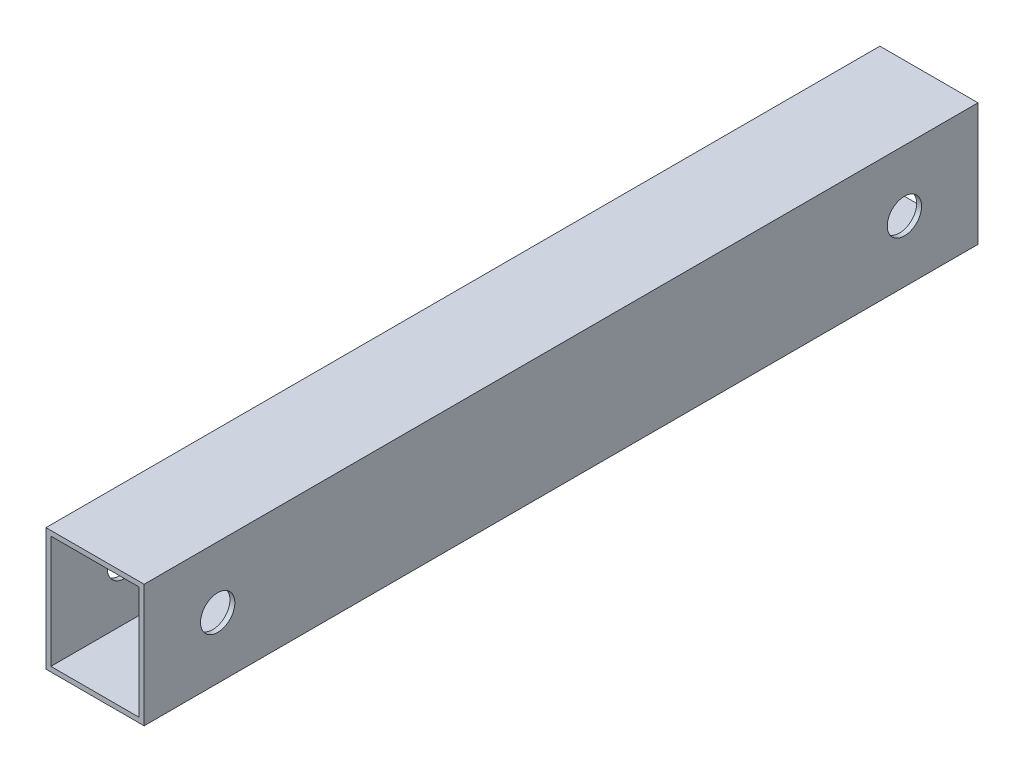
from build123d import *

# Parameters (mm, degrees)
SKETCH1_W           = 20
SKETCH1_H           = 25
BOSS_EXTRUDE1_DEPTH = 170
SHELL1_T            = -1
SKETCH2_R           = 3.5
CUT_EXTRUDE1_DEPTH  = 170


with BuildPart() as part:
    # Sketch1 → Boss-Extrude1 (new body)
    with BuildSketch(Plane.XY):
        with Locations((-15.769295372, -6.071428571)):
            Rectangle(SKETCH1_W, SKETCH1_H)
    extrude(amount=BOSS_EXTRUDE1_DEPTH)

    # Shell1
    shell1_openings = [part.faces().sort_by_distance(p)[0] for p in [
        (-15.769295372, -6.071428571, 170),
        (-15.769295372, -6.071428571, 0),
    ]]
    offset(amount=SHELL1_T, openings=shell1_openings, kind=Kind.INTERSECTION)

    # Sketch2 → Cut-Extrude1 (cut)
    with BuildSketch(Plane.ZY.offset(25.769295372)):
        with Locations(Location((15, -6.071428571, 0), (0, 0, 270))):
            Circle(SKETCH2_R)
        with Locations(Location((155, -6.071428571, 0), (0, 0, 270))):
            Circle(SKETCH2_R)
    extrude(amount=-CUT_EXTRUDE1_DEPTH, mode=Mode.SUBTRACT)


solid = part.part
